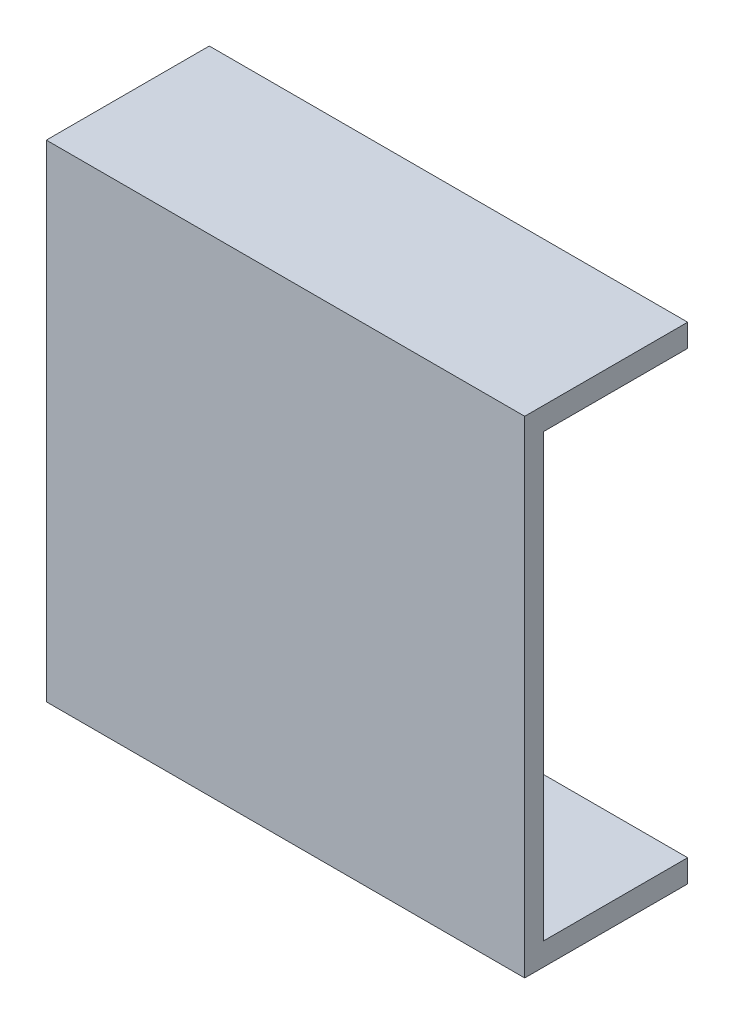
from build123d import *

# Parameters (mm, degrees)
SKETCH_1_W          = 295
SKETCH_1_H          = 300
SKETCH_1_R          = 13
EXTRUDE_530_DEPTH   = 11.5
SKETCH_2_W          = 295
SKETCH_2_H          = 14
EXTRUDE_1_DEPTH     = 89
SKETCH_3_R          = 13
CUT_EXTRUDE_1_DEPTH = 346.943998358
SKETCH_4_W          = 295
SKETCH_4_H          = 272
EXTRUDE_2_DEPTH     = 11.5
SKETCH_5_W          = 295
SKETCH_5_H          = 14
EXTRUDE_3_DEPTH     = 89


with BuildPart() as part:
    # 草图1 → Extrude 530 (new body)
    with BuildSketch(Plane.XY):
        with Locations((0, 150)):
            Rectangle(SKETCH_1_W, SKETCH_1_H)
        with Locations((92.5, 230)):
            Circle(SKETCH_1_R, mode=Mode.SUBTRACT)
        with Locations((92.5, 150)):
            Circle(SKETCH_1_R, mode=Mode.SUBTRACT)
        with Locations((92.5, 70)):
            Circle(SKETCH_1_R, mode=Mode.SUBTRACT)
        with Locations((12.5, 230)):
            Circle(SKETCH_1_R, mode=Mode.SUBTRACT)
        with Locations((-67.5, 230)):
            Circle(SKETCH_1_R, mode=Mode.SUBTRACT)
        with Locations((-67.5, 150)):
            Circle(SKETCH_1_R, mode=Mode.SUBTRACT)
        with Locations((-67.5, 70)):
            Circle(SKETCH_1_R, mode=Mode.SUBTRACT)
        with Locations((12.5, 70)):
            Circle(SKETCH_1_R, mode=Mode.SUBTRACT)
        with Locations((12.5, 150)):
            Circle(SKETCH_1_R, mode=Mode.SUBTRACT)
    extrude(amount=EXTRUDE_530_DEPTH)

    # 草图2 → 凸台-拉伸1 (add)
    with BuildSketch(Plane(origin=(0, 0, 0), x_dir=(-1, 0, 0), z_dir=(0, 0, -1))):
        with Locations((0, 293)):
            Rectangle(SKETCH_2_W, SKETCH_2_H)
        with Locations((0, 7)):
            Rectangle(SKETCH_2_W, SKETCH_2_H)
    extrude(amount=EXTRUDE_1_DEPTH)

    # 草图3 → 切除-拉伸1 (cut, through all)
    with BuildSketch(Plane(origin=(0, 300, 0), x_dir=(-1, 0, 0), z_dir=(0, 1, 0))):
        with Locations(Location((-27.5, -53.5, 0), (0, 0, 90))):
            Circle(SKETCH_3_R)
        with Locations(Location((52.5, -53.5, 0), (0, 0, 90))):
            Circle(SKETCH_3_R)
    extrude(amount=-CUT_EXTRUDE_1_DEPTH, mode=Mode.SUBTRACT)

    # 草图4 → 凸台-拉伸2 (add)
    with BuildSketch(Plane(origin=(0, 0, 0), x_dir=(-1, 0, 0), z_dir=(0, 0, -1))):
        with Locations((0, 150)):
            Rectangle(SKETCH_4_W, SKETCH_4_H)
    extrude(amount=-EXTRUDE_2_DEPTH)

    # 草图5 → 凸台-拉伸3 (add)
    with BuildSketch(Plane(origin=(0, 0, -89), x_dir=(-1, 0, 0), z_dir=(0, 0, -1))):
        with Locations((0, 293)):
            Rectangle(SKETCH_5_W, SKETCH_5_H)
        with Locations((0, 7)):
            Rectangle(SKETCH_5_W, SKETCH_5_H)
    extrude(amount=-EXTRUDE_3_DEPTH)


solid = part.part
